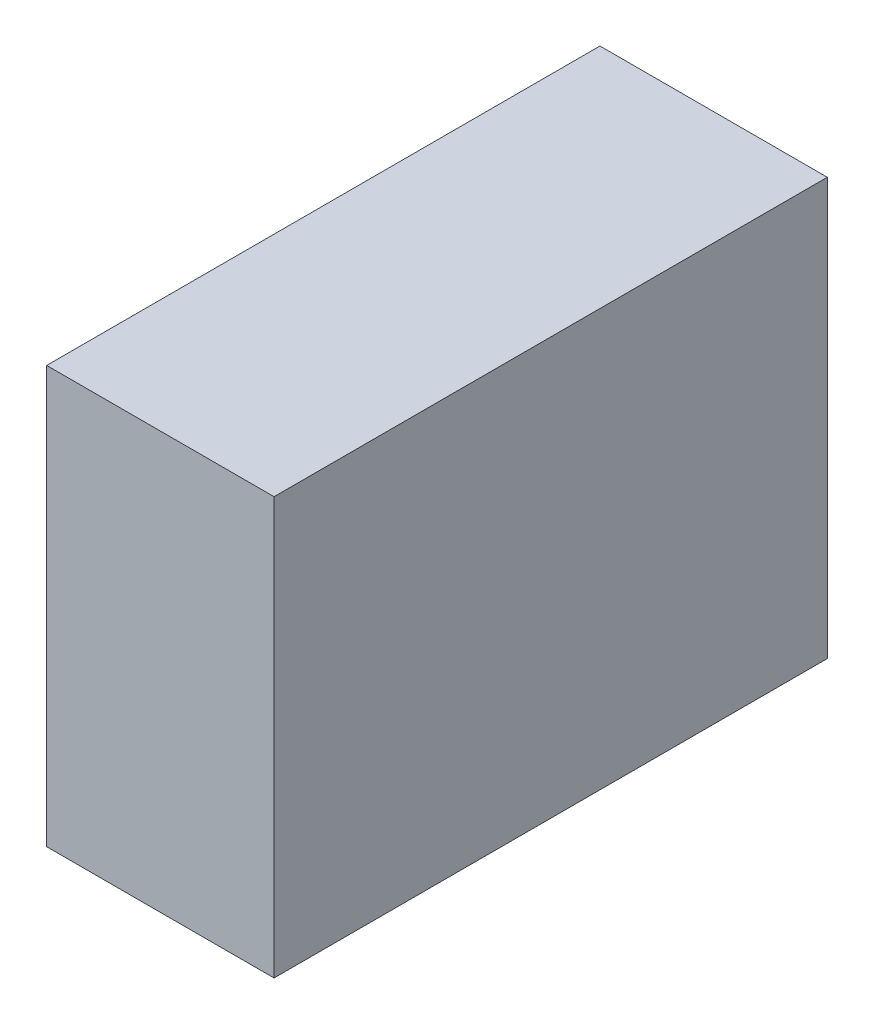
from build123d import *

# Parameters (mm, degrees)
SKETCH1_W           = 762
SKETCH1_H           = 1854.2
BOSS_EXTRUDE1_DEPTH = 1397


with BuildPart() as part:
    # Sketch1 → Boss-Extrude1 (new body)
    with BuildSketch(Plane(origin=(0, 0, 0), x_dir=(1, 0, 0), z_dir=(0, 1, 0))):
        Rectangle(SKETCH1_W, SKETCH1_H)
    extrude(amount=BOSS_EXTRUDE1_DEPTH)


solid = part.part
